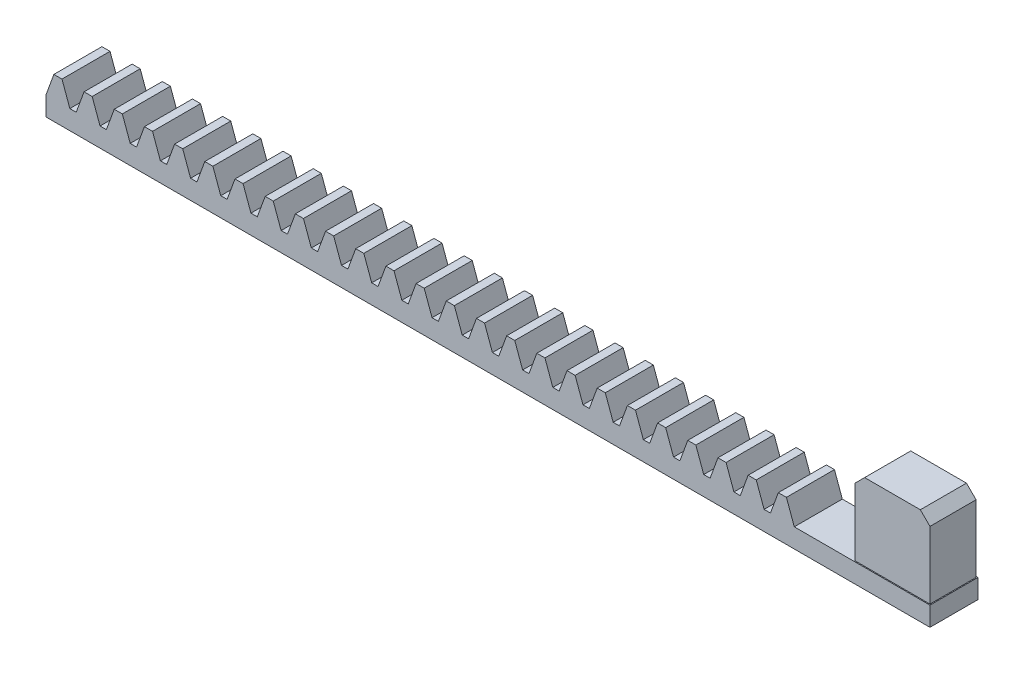
from build123d import *

# Parameters (mm, degrees)
SKETCH_1_W             = 80
SKETCH_1_H             = 10
EXTRUDE_1_DEPTH        = 5
EXTRUDE_2_DEPTH        = 5
PATTERN_LINEAR_1_COUNT = 25
PATTERN_LINEAR_1_PITCH = 3.141592654
SKETCH_3_W             = 80
SKETCH_3_H             = 8
CUT_EXTRUDE_1_DEPTH    = 10
EXTRUDE_1_2_DEPTH      = 5
SKETCH_5_W             = 8
SKETCH_5_H             = 5
SKETCH_5_W_2           = 7.8
SKETCH_5_H_2           = 4.8
CUT_EXTRUDE_3_DEPTH    = 8
CHAMFER_1_SIZE         = 1


with BuildPart() as part:
    # 草图1 → Extrude 1 (new body)
    with BuildSketch(Plane.XY):
        with Locations((40, -5)):
            Rectangle(SKETCH_1_W, SKETCH_1_H)
    extrude(amount=EXTRUDE_1_DEPTH)

    # 草图2 → 拉伸2 (add)
    with BuildSketch(Plane.XY.offset(5)):
        Polygon((0, 0), (0.818933027, 2.25), (1.661788885, 2.25), (2.480721912, 0), align=None)
    extrude_2 = extrude(amount=-EXTRUDE_2_DEPTH)

    # 阵列(线性)1: 拉伸2 ×25
    with Locations(*[(i * PATTERN_LINEAR_1_PITCH, 0, 0) for i in range(1, PATTERN_LINEAR_1_COUNT)]):
        add(extrude_2)

    # 草图3 → 切除-拉伸1 (cut)
    with BuildSketch(Plane.XY.offset(5)):
        with Locations((40, -6)):
            Rectangle(SKETCH_3_W, SKETCH_3_H)
    extrude(amount=-CUT_EXTRUDE_1_DEPTH, mode=Mode.SUBTRACT)

    # 草图4 → Extrude 1 2 (add)
    with BuildSketch(Plane.XY.offset(5)):
        Polygon((80, 0), (84, 0), (84, 8), (92, 8), (92, 0), (92, -2), (80, -2), align=None)
    extrude(amount=-EXTRUDE_1_2_DEPTH)

    # 草图5 → 切除-拉伸3 (cut)
    with BuildSketch(Plane(origin=(0, 8, 0), x_dir=(1, 0, 0), z_dir=(0, 1, 0))):
        with Locations((88, -2.5)):
            Rectangle(SKETCH_5_W, SKETCH_5_H)
        with Locations((88, -2.5)):
            Rectangle(SKETCH_5_W_2, SKETCH_5_H_2, mode=Mode.SUBTRACT)
    extrude(amount=-CUT_EXTRUDE_3_DEPTH, mode=Mode.SUBTRACT)

    # 倒角1
    chamfer_1_edges = [part.edges().sort_by_distance(p)[0] for p in [
        (84.1, 8, 2.5),
        (91.9, 8, 2.5),
    ]]
    chamfer(chamfer_1_edges, length=CHAMFER_1_SIZE)


solid = part.part
